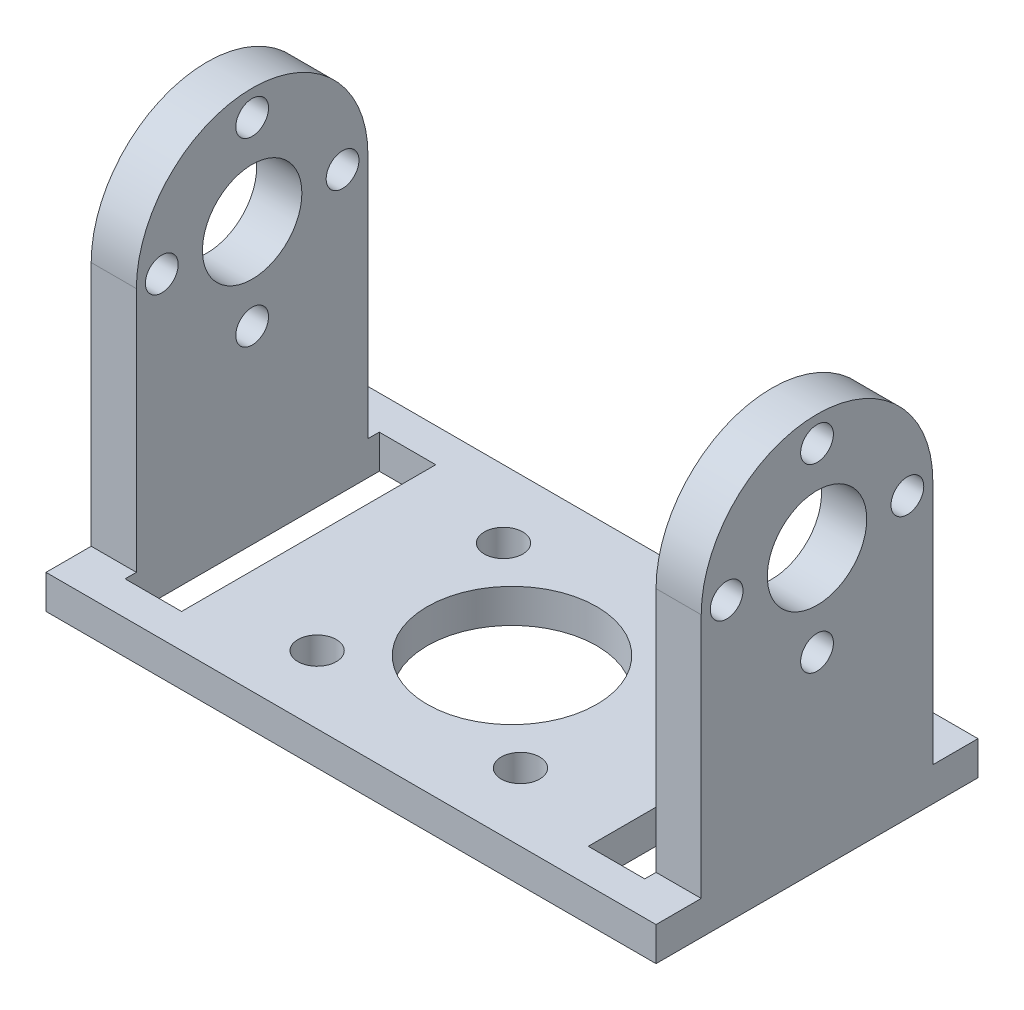
from build123d import *

# Parameters (mm, degrees)
SKETCH1_W           = 54
SKETCH1_H           = 28.5
SKETCH1_W_2         = 5
SKETCH1_H_2         = 22.5
SKETCH1_R           = 1.7
SKETCH1_R_2         = 7.5
BOSS_EXTRUDE2_DEPTH = 3
SKETCH2_W           = 4
SKETCH2_H           = 20.5
BOSS_EXTRUDE3_DEPTH = 21.75
SKETCH4_R           = 10.25
BOSS_EXTRUDE4_DEPTH = 4
SKETCH6_R           = 4.4
SKETCH6_R_2         = 1.45
CUT_EXTRUDE3_DEPTH  = 4


with BuildPart() as part:
    # Sketch1 → Boss-Extrude2 (new body)
    with BuildSketch(Plane(origin=(0, 0, 0), x_dir=(1, 0, 0), z_dir=(0, 1, 0))):
        Rectangle(SKETCH1_W, SKETCH1_H)
        with Locations((20.5, 0)):
            Rectangle(SKETCH1_W_2, SKETCH1_H_2, mode=Mode.SUBTRACT)
        with Locations((-20.5, 0)):
            Rectangle(SKETCH1_W_2, SKETCH1_H_2, mode=Mode.SUBTRACT)
        with Locations(Location((-9, -8.25, 0), (0, 0, 270))):
            Circle(SKETCH1_R, mode=Mode.SUBTRACT)
        with Locations(Location((9, -8.25, 0), (0, 0, 270))):
            Circle(SKETCH1_R, mode=Mode.SUBTRACT)
        with Locations(Location((-9, 8.25, 0), (0, 0, 270))):
            Circle(SKETCH1_R, mode=Mode.SUBTRACT)
        with Locations(Location((0, 0, 0), (0, 0, 270))):
            Circle(SKETCH1_R_2, mode=Mode.SUBTRACT)
        with Locations(Location((9, 8.25, 0), (0, 0, 270))):
            Circle(SKETCH1_R, mode=Mode.SUBTRACT)
    extrude(amount=BOSS_EXTRUDE2_DEPTH)

    # Sketch2 → Boss-Extrude3 (add)
    with BuildSketch(Plane(origin=(0, 3, 0), x_dir=(1, 0, 0), z_dir=(0, 1, 0))):
        with Locations((25, 0)):
            Rectangle(SKETCH2_W, SKETCH2_H)
    boss_extrude3 = extrude(amount=BOSS_EXTRUDE3_DEPTH)

    # Sketch4 → Boss-Extrude4 (add)
    with BuildSketch(Plane(origin=(27, 0, 0), x_dir=(0, 0, -1), z_dir=(1, 0, 0))):
        with Locations((0, 24.75)):
            Circle(SKETCH4_R)
    boss_extrude4 = extrude(amount=-BOSS_EXTRUDE4_DEPTH)

    # Mirror1: Boss-Extrude3, Boss-Extrude4 across plane
    add(boss_extrude3.mirror(Plane(origin=(0, 0, 0), x_dir=(0, 0, 1), z_dir=(1, 0, 0))))
    add(boss_extrude4.mirror(Plane(origin=(0, 0, 0), x_dir=(0, 0, 1), z_dir=(1, 0, 0))))

    # Sketch6 → Cut-Extrude3 (cut)
    with BuildSketch(Plane(origin=(27, 0, 0), x_dir=(0, 0, -1), z_dir=(1, 0, 0))):
        with Locations((0, 24.75)):
            Circle(SKETCH6_R)
        with Locations((0, 32.75)):
            Circle(SKETCH6_R_2)
        with Locations((8, 24.75)):
            Circle(SKETCH6_R_2)
        with Locations((0, 16.75)):
            Circle(SKETCH6_R_2)
        with Locations((-8, 24.75)):
            Circle(SKETCH6_R_2)
    cut_extrude3 = extrude(amount=-CUT_EXTRUDE3_DEPTH, mode=Mode.SUBTRACT)

    # Mirror3: Cut-Extrude3 across plane
    add(cut_extrude3.mirror(Plane(origin=(0, 0, 0), x_dir=(0, 0, 1), z_dir=(1, 0, 0))), mode=Mode.SUBTRACT)


solid = part.part
